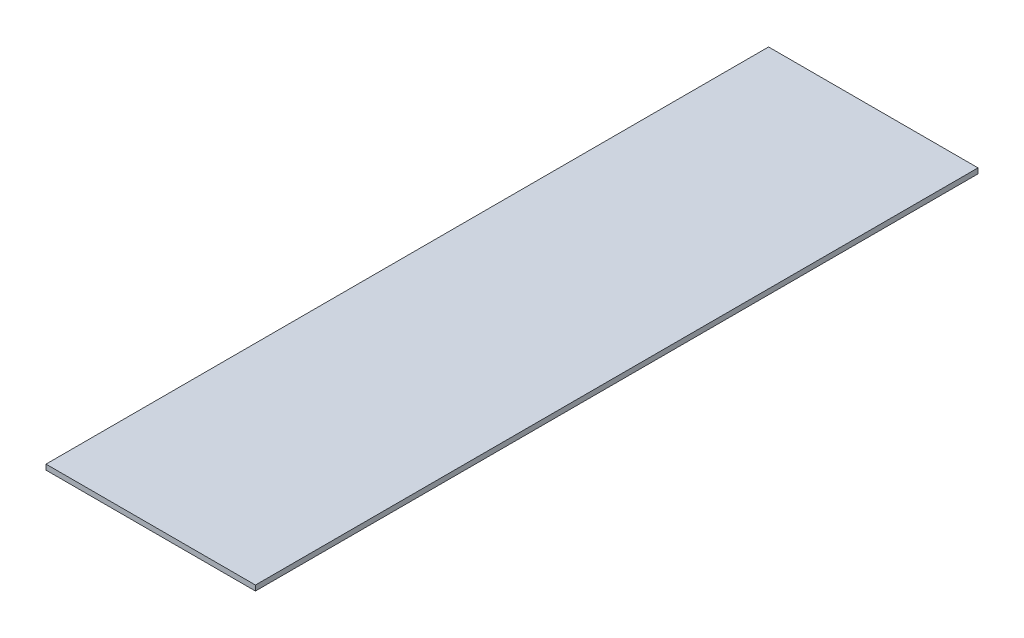
from build123d import *

# Parameters (mm, degrees)
SKETCH_1_W      = 200
SKETCH_1_H      = 5
EXTRUDE_1_DEPTH = 345


with BuildPart() as part:
    # Эскиз1 → Бобышка-Вытянуть1 (new, symmetric)
    with BuildSketch(Plane.XY):
        Rectangle(SKETCH_1_W, SKETCH_1_H)
    extrude(amount=EXTRUDE_1_DEPTH, both=True)


solid = part.part
